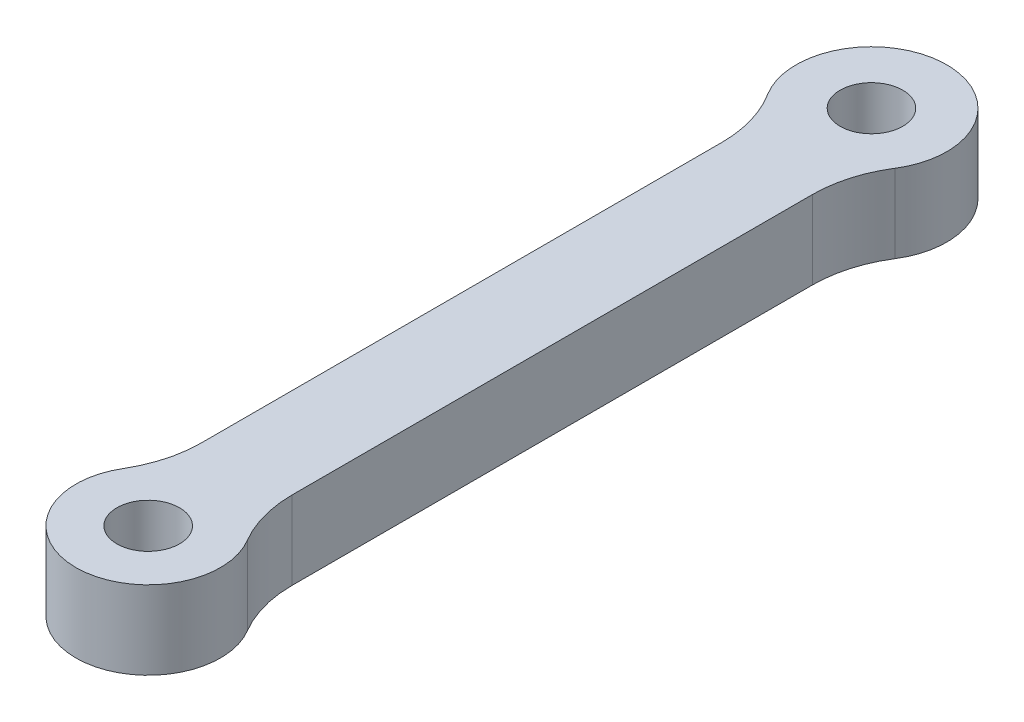
from build123d import *

# Parameters (mm, degrees)
SKETCH1_R           = 6.25
SKETCH1_R_2         = 2.6
SKETCH1_R_3         = 6
SKETCH1_W           = 7.5
SKETCH1_H           = 50.316251501
BOSS_EXTRUDE1_DEPTH = 6.5
FILLET1_R           = 10


with BuildPart() as part:
    # Sketch1 → Boss-Extrude1 (new body)
    # profile 1 of 3: a face of its own
    with BuildSketch(Plane(origin=(0, 0, 0), x_dir=(1, 0, 0), z_dir=(0, 1, 0))):
        with Locations((0, 60)):
            Circle(SKETCH1_R)
        with Locations(Location((0, 60, 0), (0, 0, 90))):
            Circle(SKETCH1_R_2, mode=Mode.SUBTRACT)
    # profile 2 of 3: a face of its own
    with BuildSketch(Plane(origin=(0, 0, 0), x_dir=(1, 0, 0), z_dir=(0, 1, 0))):
        Circle(SKETCH1_R_3)
        with Locations(Location((0, 0, 0), (0, 0, 90))):
            Circle(SKETCH1_R_2, mode=Mode.SUBTRACT)
    # profile 3 of 3: a face of its own
    with BuildSketch(Plane(origin=(0, 0, 0), x_dir=(1, 0, 0), z_dir=(0, 1, 0))):
        with Locations((0, 29.84187425)):
            Rectangle(SKETCH1_W, SKETCH1_H)
    extrude(amount=BOSS_EXTRUDE1_DEPTH)

    # Fillet1
    fillet1_edges = [part.edges().sort_by_distance(p)[0] for p in [
        (-3.75, 3.25, -55),
        (3.75, 3.25, -55),
        (3.75, 3.25, -4.683748499),
        (-3.75, 3.25, -4.683748499),
    ]]
    fillet(fillet1_edges, radius=FILLET1_R)


solid = part.part
